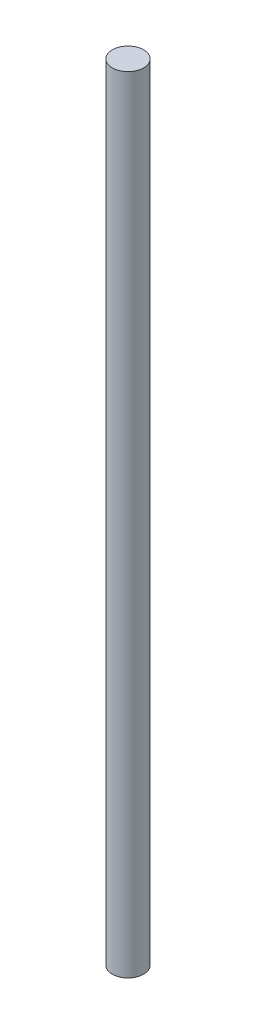
from build123d import *

# Parameters (mm, degrees)
SKETCH2_W = 8
SKETCH2_H = 400


with BuildPart() as part:
    # Sketch2 → Revolve1 (revolve)
    with BuildSketch(Plane.XY, mode=Mode.PRIVATE) as revolve1_sk:
        with Locations((-4, 0)):
            Rectangle(SKETCH2_W, SKETCH2_H)
    revolve(revolve1_sk.sketch.rotate(Axis((0, 256.599391649, 0), (0, -1, 0)), 270), axis=Axis((0, 256.599391649, 0), (0, -1, 0)))


solid = part.part
